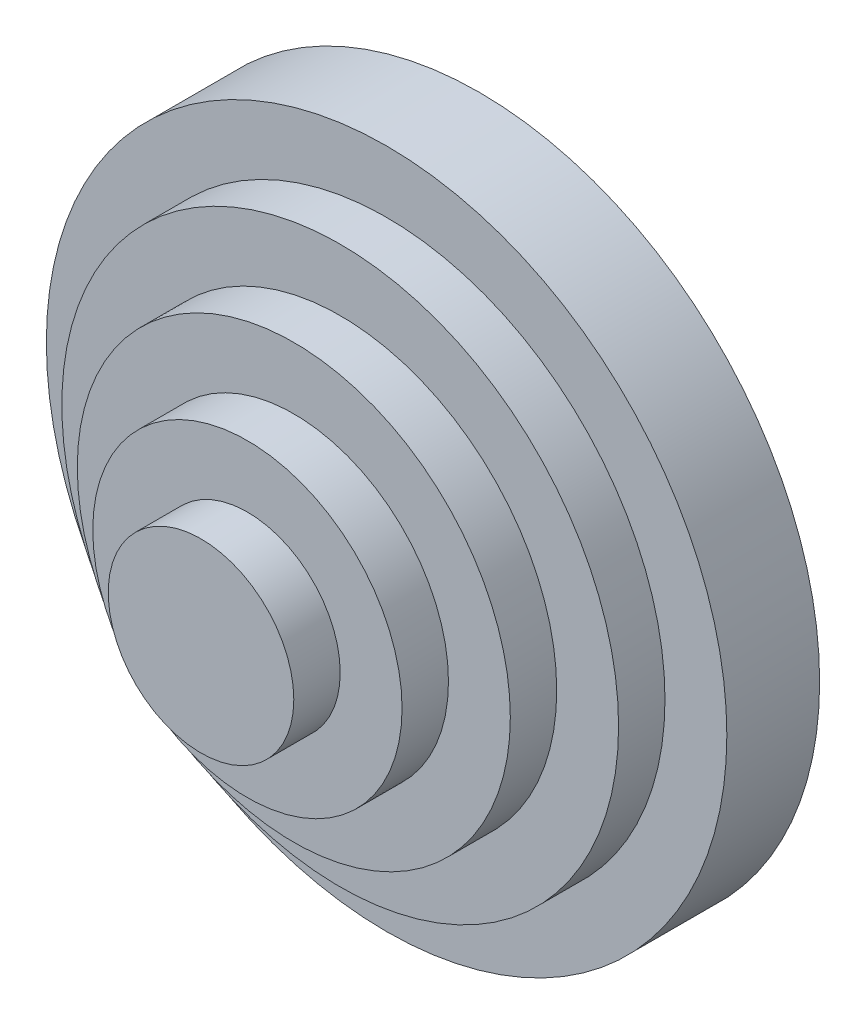
from build123d import *

# Parameters (mm, degrees)
SKETCH1_R      = 11
EXTRUDE1_DEPTH = 3
SKETCH2_R      = 9
EXTRUDE2_DEPTH = 1.5
SKETCH3_R      = 7
EXTRUDE3_DEPTH = 1.5
SKETCH4_R      = 5
EXTRUDE4_DEPTH = 1.5
SKETCH5_R      = 3
EXTRUDE5_DEPTH = 1.5


with BuildPart() as part:
    # Sketch1 → Extrude1 (new body)
    with BuildSketch(Plane.XY):
        Circle(SKETCH1_R)
        with BuildLine():
            Line((2.224859546, 4.7), (-2.224859546, 4.7))
            ThreePointArc((-2.224859546, 4.7), (-3.676955262, 3.676955262), (-4.7, 2.224859546))
            Line((-4.7, 2.224859546), (-4.7, -2.224859546))
            ThreePointArc((-4.7, -2.224859546), (-3.676955262, -3.676955262), (-2.224859546, -4.7))
            Line((-2.224859546, -4.7), (2.224859546, -4.7))
            ThreePointArc((2.224859546, -4.7), (3.676955262, -3.676955262), (4.7, -2.224859546))
            Line((4.7, -2.224859546), (4.7, 2.224859546))
            ThreePointArc((4.7, 2.224859546), (3.676955262, 3.676955262), (2.224859546, 4.7))
        make_face(mode=Mode.SUBTRACT)
    extrude(amount=-EXTRUDE1_DEPTH)

    # Sketch2 → Extrude2 (add)
    with BuildSketch(Plane.XY):
        Circle(SKETCH2_R)
    extrude(amount=EXTRUDE2_DEPTH)

    # Sketch3 → Extrude3 (add)
    with BuildSketch(Plane.XY.offset(1.5)):
        Circle(SKETCH3_R)
    extrude(amount=EXTRUDE3_DEPTH)

    # Sketch4 → Extrude4 (add)
    with BuildSketch(Plane.XY.offset(3)):
        Circle(SKETCH4_R)
    extrude(amount=EXTRUDE4_DEPTH)

    # Sketch5 → Extrude5 (add)
    with BuildSketch(Plane.XY.offset(4.5)):
        Circle(SKETCH5_R)
    extrude(amount=EXTRUDE5_DEPTH)


solid = part.part
